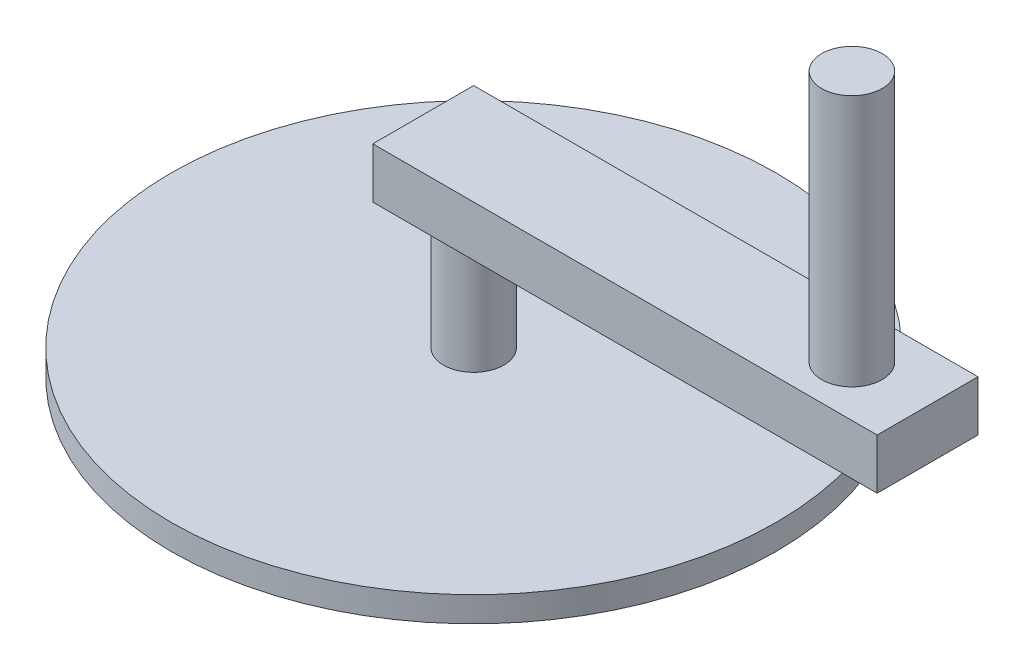
from build123d import *

# Parameters (mm, degrees)
SKETCH_1_W      = 100
SKETCH_1_H      = 20
EXTRUDE_1_DEPTH = 10
SKETCH_4_R      = 6
EXTRUDE_2_DEPTH = 50
SKETCH_6_R      = 6
EXTRUDE_3_DEPTH = 30
SKETCH_7_R      = 30
EXTRUDE_4_DEPTH = 5
SKETCH_8_R      = 60
EXTRUDE_5_DEPTH = 5


with BuildPart() as part:
    # ｽｹｯﾁ1 → ﾎﾞｽ - 押し出し1 (new body)
    with BuildSketch(Plane(origin=(0, 0, 0), x_dir=(1, 0, 0), z_dir=(0, 1, 0))):
        with Locations((-50, 10)):
            Rectangle(SKETCH_1_W, SKETCH_1_H)
    extrude(amount=EXTRUDE_1_DEPTH)

    # ｽｹｯﾁ4 → ﾎﾞｽ - 押し出し2 (add)
    with BuildSketch(Plane(origin=(0, 10, 0), x_dir=(1, 0, 0), z_dir=(0, 1, 0))):
        with Locations(Location((-15, 10, 0), (0, 0, 270))):
            Circle(SKETCH_4_R)
    extrude(amount=EXTRUDE_2_DEPTH)

    # ｽｹｯﾁ6 → ﾎﾞｽ - 押し出し3 (add)
    with BuildSketch(Plane.XZ):
        with Locations(Location((-90, -10, 0), (0, 0, 90))):
            Circle(SKETCH_6_R)
    extrude(amount=EXTRUDE_3_DEPTH)

    # ｽｹｯﾁ7 → ﾎﾞｽ - 押し出し4 (add)
    with BuildSketch(Plane.XZ.offset(30)):
        with Locations(Location((-90, -10, 0), (0, 0, 270))):
            Circle(SKETCH_7_R)
    extrude(amount=EXTRUDE_4_DEPTH)

    # ｽｹｯﾁ8 → ﾎﾞｽ - 押し出し5 (add)
    with BuildSketch(Plane(origin=(0, -30, 0), x_dir=(1, 0, 0), z_dir=(0, 1, 0))):
        with Locations(Location((-90, 10, 0), (0, 0, 270))):
            Circle(SKETCH_8_R)
    extrude(amount=EXTRUDE_5_DEPTH)


solid = part.part
